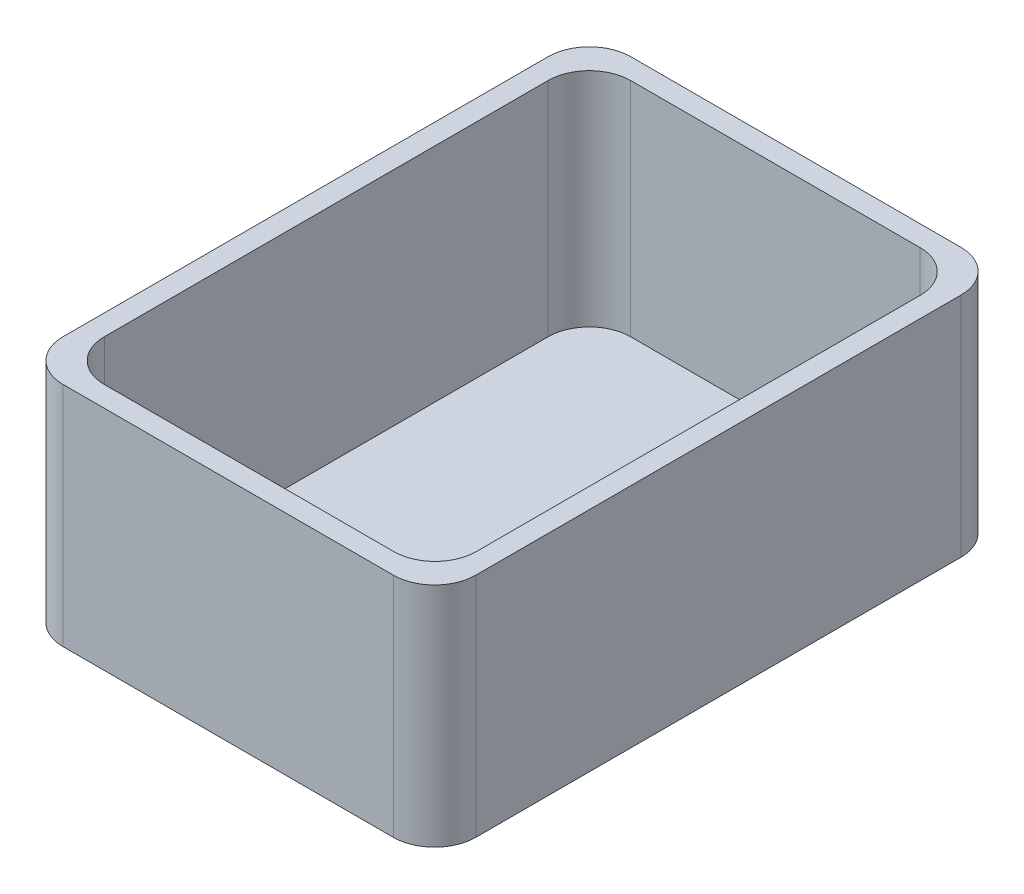
from build123d import *

# Parameters (mm, degrees)
SKETCH1_W           = 400
SKETCH1_H           = 550
BOSS_EXTRUDE1_DEPTH = 220
SKETCH2_W           = 360.460384802
SKETCH2_H           = 509.949814821
CUT_EXTRUDE1_DEPTH  = 215
FILLET2_R           = 40
FILLET3_R           = 40


with BuildPart() as part:
    # Sketch1 → Boss-Extrude1 (new body)
    with BuildSketch(Plane(origin=(0, 0, 0), x_dir=(1, 0, 0), z_dir=(0, 1, 0))):
        Rectangle(SKETCH1_W, SKETCH1_H)
    extrude(amount=BOSS_EXTRUDE1_DEPTH)

    # Sketch2 → Cut-Extrude1 (cut)
    with BuildSketch(Plane(origin=(0, 220, 0), x_dir=(1, 0, 0), z_dir=(0, 1, 0))):
        with Locations((0.230192401, -0.02509259)):
            Rectangle(SKETCH2_W, SKETCH2_H)
    extrude(amount=-CUT_EXTRUDE1_DEPTH, mode=Mode.SUBTRACT)

    # Fillet2
    fillet2_edges = [part.edges().sort_by_distance(p)[0] for p in [
        (200, 110, 275),
        (-200, 110, 275),
        (-200, 110, -275),
        (200, 110, -275),
    ]]
    fillet(fillet2_edges, radius=FILLET2_R)

    # Fillet3
    fillet3_edges = [part.edges().sort_by_distance(p)[0] for p in [
        (180.460384802, 112.5, -254.949814821),
        (180.460384802, 112.5, 255),
        (-180, 112.5, 255),
        (-180, 112.5, -254.949814821),
    ]]
    fillet(fillet3_edges, radius=FILLET3_R)


solid = part.part
